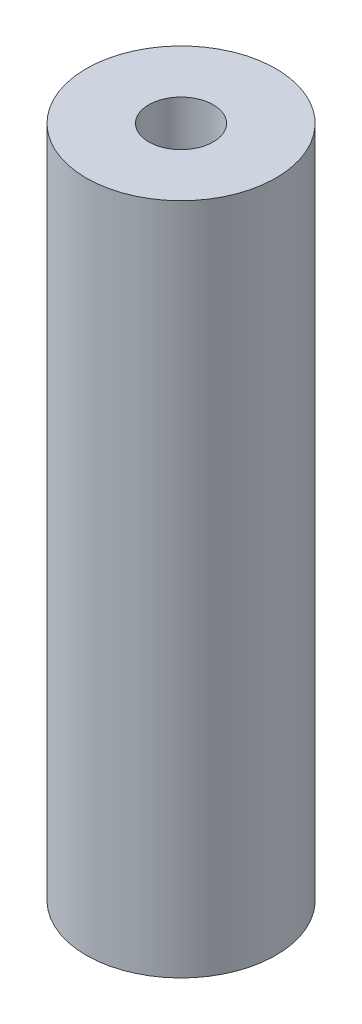
from build123d import *

# Parameters (mm, degrees)
SKETCH1_R            = 5
BOSS_EXTRUDE1_DEPTH  = 35.5
M3_CLEARANCE_HOLE1_D = 3.4


with BuildPart() as part:
    # Sketch1 → Boss-Extrude1 (new body)
    with BuildSketch(Plane(origin=(0, 0, 0), x_dir=(1, 0, 0), z_dir=(0, 1, 0))):
        with Locations(Location((0, 0, 0), (0, 0, 270))):
            Circle(SKETCH1_R)
    extrude(amount=BOSS_EXTRUDE1_DEPTH)

    # M3 Clearance Hole1 (through all)
    with Locations(Plane(origin=(0, 35.5, 0), x_dir=(1, 0, 0), z_dir=(0, 1, 0))):
        with Locations((0, 0)):
            Hole(M3_CLEARANCE_HOLE1_D / 2)


solid = part.part
